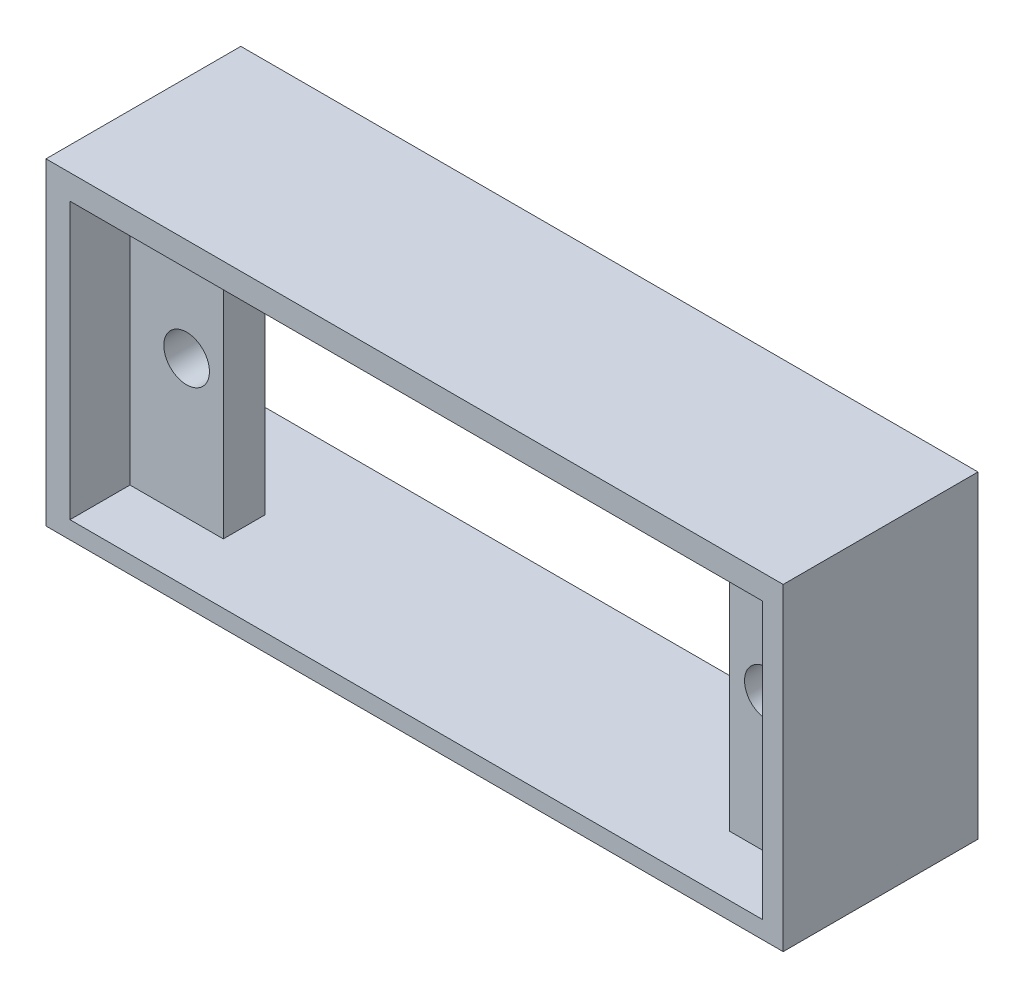
from build123d import *

# Parameters (mm, degrees)
BOSS_EXTRUDE1_DEPTH = 25
SKETCH16_W          = 33.4
SKETCH16_H          = 13.3
CUT_EXTRUDE10_DEPTH = 4.5
SKETCH19_R          = 20
CUT_EXTRUDE14_DEPTH = 5
SKETCH17_W          = 24.4
SKETCH17_H          = 13.3
CUT_EXTRUDE11_DEPTH = 177.45821035
CUT_EXTRUDE13_DEPTH = 6.45
SKETCH20_W          = 33.4
SKETCH20_H          = 13.3
CUT_EXTRUDE15_DEPTH = 176.655202029
SKETCH21_R          = 1.1
CUT_EXTRUDE16_DEPTH = 177.45821035
SKETCH22_R          = 2
CUT_EXTRUDE17_DEPTH = 20
SKETCH23_W          = 35.542805721
SKETCH23_H          = 15.334329657
SKETCH23_R          = 20
CUT_EXTRUDE18_DEPTH = 177.45821035
SKETCH24_W          = 18.060519465
SKETCH24_H          = 23.66068054
CUT_EXTRUDE19_DEPTH = 45.156146987


with BuildPart() as part:
    # Sketch1 → Boss-Extrude1 (new body)
    with BuildSketch(Plane.XY):
        with BuildLine():
            ThreePointArc((172.5, 0), (152.823244805, 26.363741023), (121.951138857, 15))
            Line((121.951138857, 15), (145, 15))
            Line((145, 15), (145, -15))
            Line((145, -15), (121.951138857, -15))
            ThreePointArc((121.951138857, -15), (152.823244805, -26.363741023), (172.5, 0))
        make_face()
        with BuildLine():
            Line((145, 15), (121.951138857, 15))
            ThreePointArc((121.951138857, 15), (117.5, 0), (121.951138857, -15))
            Line((121.951138857, -15), (145, -15))
            Line((145, -15), (145, 15))
        make_face()
        with BuildLine():
            Line((121.951138857, 15), (23.048861143, 15))
            ThreePointArc((23.048861143, 15), (26.363741023, 7.823244805), (27.5, 0))
            ThreePointArc((27.5, 0), (26.363741023, -7.823244805), (23.048861143, -15))
            Line((23.048861143, -15), (121.951138857, -15))
            ThreePointArc((121.951138857, -15), (117.5, 0), (121.951138857, 15))
        make_face()
        with BuildLine():
            ThreePointArc((13.228756555, -15), (-20, 0), (13.228756555, 15))
            Line((13.228756555, 15), (23.048861143, 15))
            ThreePointArc((23.048861143, 15), (-27.5, 0), (23.048861143, -15))
            Line((23.048861143, -15), (13.228756555, -15))
        make_face()
        with BuildLine():
            Line((23.048861143, 15), (13.228756555, 15))
            ThreePointArc((13.228756555, 15), (18.228756555, 8.228756555), (20, 0))
            ThreePointArc((20, 0), (18.228756555, -8.228756555), (13.228756555, -15))
            Line((13.228756555, -15), (23.048861143, -15))
            ThreePointArc((23.048861143, -15), (26.363741023, -7.823244805), (27.5, 0))
            ThreePointArc((27.5, 0), (26.363741023, 7.823244805), (23.048861143, 15))
        make_face()
        with BuildLine():
            Line((0, -15), (0, 15))
            Line((0, 15), (13.228756555, 15))
            ThreePointArc((13.228756555, 15), (-20, 0), (13.228756555, -15))
            Line((13.228756555, -15), (0, -15))
        make_face()
        with BuildLine():
            Line((13.228756555, 15), (0, 15))
            Line((0, 15), (0, -15))
            Line((0, -15), (13.228756555, -15))
            ThreePointArc((13.228756555, -15), (18.228756555, -8.228756555), (20, 0))
            ThreePointArc((20, 0), (18.228756555, 8.228756555), (13.228756555, 15))
        make_face()
    extrude(amount=BOSS_EXTRUDE1_DEPTH)

    # Sketch16 → Cut-Extrude10 (cut)
    with BuildSketch(Plane(origin=(0, 0, 0), x_dir=(-1, 0, 0), z_dir=(0, 0, -1))):
        with Locations((-150.21934279, 0)):
            Rectangle(SKETCH16_W, SKETCH16_H)
    extrude(amount=-CUT_EXTRUDE10_DEPTH, mode=Mode.SUBTRACT)

    # Sketch19 → Cut-Extrude14 (cut)
    with BuildSketch(Plane(origin=(0, 0, 0), x_dir=(-1, 0, 0), z_dir=(0, 0, -1))):
        Circle(SKETCH19_R)
    extrude(amount=-CUT_EXTRUDE14_DEPTH, mode=Mode.SUBTRACT)

    # Sketch17 → Cut-Extrude11 (cut, through all)
    with BuildSketch(Plane(origin=(0, 0, 0), x_dir=(-1, 0, 0), z_dir=(0, 0, -1))):
        with Locations((-150.21934279, 0)):
            Rectangle(SKETCH17_W, SKETCH17_H)
    extrude(amount=-CUT_EXTRUDE11_DEPTH, mode=Mode.SUBTRACT)

    # Sketch18 → Cut-Extrude13 (cut, symmetric)
    with BuildSketch(Plane(origin=(0, 0, 0), x_dir=(-1, 0, 0), z_dir=(0, -1, 0))):
        Polygon((-138.01934279, -15), (-138.01934279, -25), (-122.01934279, -25), (-122.01934279, -22.5), align=None)
    extrude(amount=CUT_EXTRUDE13_DEPTH, both=True, mode=Mode.SUBTRACT)

    # Sketch20 → Cut-Extrude15 (cut, through all)
    with BuildSketch(Plane(origin=(0, 0, 6.5), x_dir=(-1, 0, 0), z_dir=(0, 0, -1))):
        with Locations((-150.21934279, 0)):
            Rectangle(SKETCH20_W, SKETCH20_H)
    extrude(amount=-CUT_EXTRUDE15_DEPTH, mode=Mode.SUBTRACT)

    # Sketch21 → Cut-Extrude16 (cut, through all)
    with BuildSketch(Plane(origin=(0, 0, 0), x_dir=(-1, 0, 0), z_dir=(0, 0, -1))):
        with Locations((-164.249999957, 0)):
            Circle(SKETCH21_R)
        with Locations((-136.249999957, 0)):
            Circle(SKETCH21_R)
    extrude(amount=-CUT_EXTRUDE16_DEPTH, mode=Mode.SUBTRACT)

    # Sketch22 → Cut-Extrude17 (cut)
    with BuildSketch(Plane.XY.offset(25)):
        Circle(SKETCH22_R)
    extrude(amount=-CUT_EXTRUDE17_DEPTH, mode=Mode.SUBTRACT)

    # Sketch23 → Cut-Extrude18 (cut, through all)
    with BuildSketch(Plane(origin=(0, 0, 0), x_dir=(-1, 0, 0), z_dir=(0, 0, -1))):
        with BuildLine():
            ThreePointArc((-121.951138857, 15), (-172.5, 0), (-121.951138857, -15))
            Line((-121.951138857, -15), (-23.048861143, -15))
            ThreePointArc((-23.048861143, -15), (27.5, 0), (-23.048861143, 15))
            Line((-23.048861143, 15), (-121.951138857, 15))
        make_face()
        with Locations((-150.134671958, 0.173388614)):
            Rectangle(SKETCH23_W, SKETCH23_H, mode=Mode.SUBTRACT)
        Circle(SKETCH23_R, mode=Mode.SUBTRACT)
    extrude(amount=-CUT_EXTRUDE18_DEPTH, mode=Mode.SUBTRACT)


with BuildPart() as cut_extrude18_kept_piece:
    # of the separate pieces the step leaves, the one the design keeps (cut_extrude18_pieces_kept)
    add(part.part.solids().sort_by_distance((133.51934279, 6.45, 25))[0])

    # Sketch24 → Cut-Extrude19 (cut, through all)
    with BuildSketch(Plane.ZY.offset(-132.363269097)):
        with Locations((18.423868143, -1.593012334)):
            Rectangle(SKETCH24_W, SKETCH24_H)
    extrude(amount=-CUT_EXTRUDE19_DEPTH, mode=Mode.SUBTRACT)


solid = cut_extrude18_kept_piece.part
